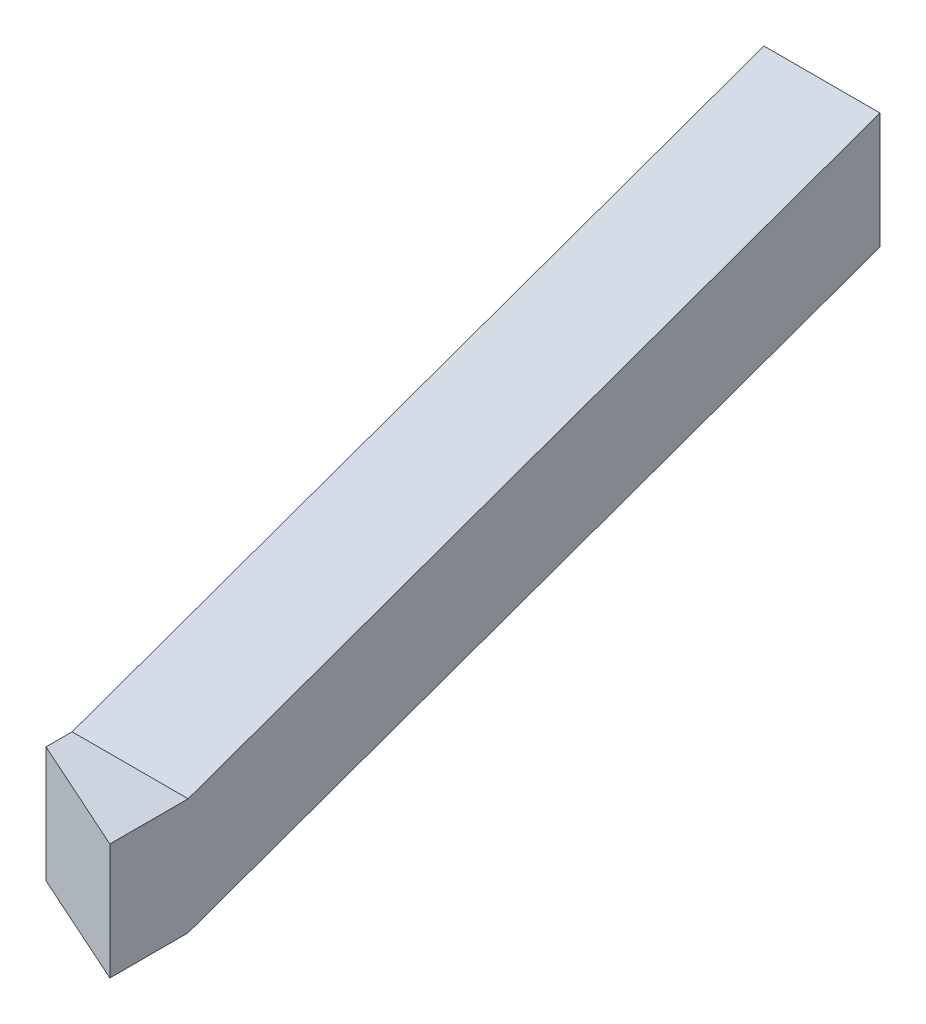
from build123d import *

# Parameters (mm, degrees)
CROQUIS1_W              = 88.9
CROQUIS1_H              = 88.9
SALIENTE_EXTRUIR1_DEPTH = 60
CROQUIS2_W              = 88.9
CROQUIS2_H              = 88.9
CORTAR_EXTRUIR1_DEPTH   = 100


with BuildPart() as part:
    # Croquis1 → Saliente-Extruir1 (new body)
    with BuildSketch(Plane.XY):
        with Locations((44.45, 44.45)):
            Rectangle(CROQUIS1_W, CROQUIS1_H)
    extrude(amount=-SALIENTE_EXTRUIR1_DEPTH)

    # Barrer1: sweep along a curve in space
    with BuildLine() as barrer1_path:
        Line((44.45, 234.45, -590), (44.45, 44.45, -60))
    # Croquis2 → Barrer1 (sweep)
    with BuildSketch(Plane(origin=(0, 0, -60), x_dir=(-1, 0, 0), z_dir=(0, 0, -1))):
        with Locations((-44.45, 44.45)):
            Rectangle(CROQUIS2_W, CROQUIS2_H)
    sweep(path=barrer1_path.line)

    # Croquis3 → Cortar-Extruir1 (cut)
    with BuildSketch(Plane(origin=(0, 88.9, 0), x_dir=(1, 0, 0), z_dir=(0, 1, 0))):
        Polygon((88.9, 0), (0, 40), (0, 0), align=None)
    extrude(amount=-CORTAR_EXTRUIR1_DEPTH, mode=Mode.SUBTRACT)


solid = part.part
